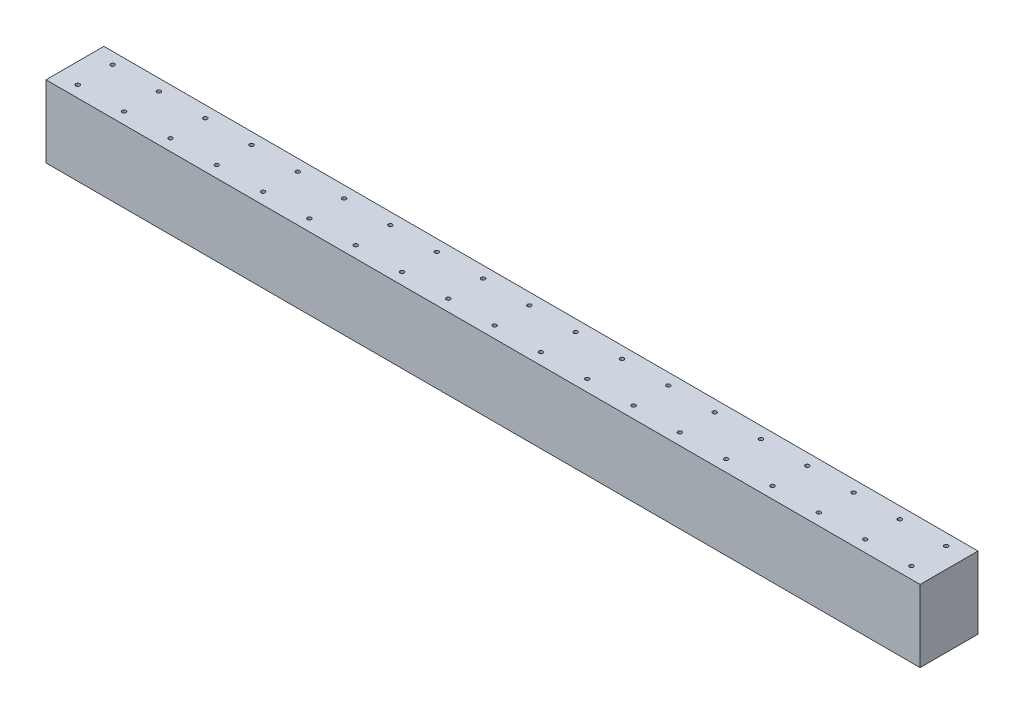
from build123d import *

# Parameters (mm, degrees)
SKETCH1_W             = 1510
SKETCH1_H             = 124.5
BOSS_EXTRUDE1_DEPTH   = 100
M8_TAPPED_HOLE1_D     = 6.8
M8_TAPPED_HOLE1_DEPTH = 22.25
M8_TAPPED_HOLE1_TIP   = 2.042926105


with BuildPart() as part:
    # Sketch1 → Boss-Extrude1 (new body)
    with BuildSketch(Plane.XY):
        with Locations((0, 77.25)):
            Rectangle(SKETCH1_W, SKETCH1_H)
    extrude(amount=-BOSS_EXTRUDE1_DEPTH)

    # M8 Tapped Hole1
    with Locations(Plane(origin=(0, 139.5, 0), x_dir=(1, 0, 0), z_dir=(0, 1, 0))):
        with Locations((720, 80), (720, 20), (640, 20), (640, 80), (560, 80), (560, 20), (480, 20), (480, 80), (400, 80), (400, 20), (320, 20), (320, 80), (240, 80), (240, 20), (160, 20), (160, 80), (80, 80), (80, 20), (0, 20), (0, 80), (-80, 80), (-80, 20), (-160, 20), (-160, 80), (-240, 80), (-240, 20), (-320, 20), (-320, 80), (-400, 80), (-400, 20), (-480, 20), (-480, 80), (-560, 20), (-560, 80), (-640, 20), (-640, 80), (-720, 80), (-720, 20)):
            Hole(M8_TAPPED_HOLE1_D / 2, depth=M8_TAPPED_HOLE1_DEPTH)
            with Locations((0, 0, -(M8_TAPPED_HOLE1_DEPTH + M8_TAPPED_HOLE1_TIP / 2))):  # 118° drill point
                Cone(0, M8_TAPPED_HOLE1_D / 2, M8_TAPPED_HOLE1_TIP, mode=Mode.SUBTRACT)


solid = part.part
